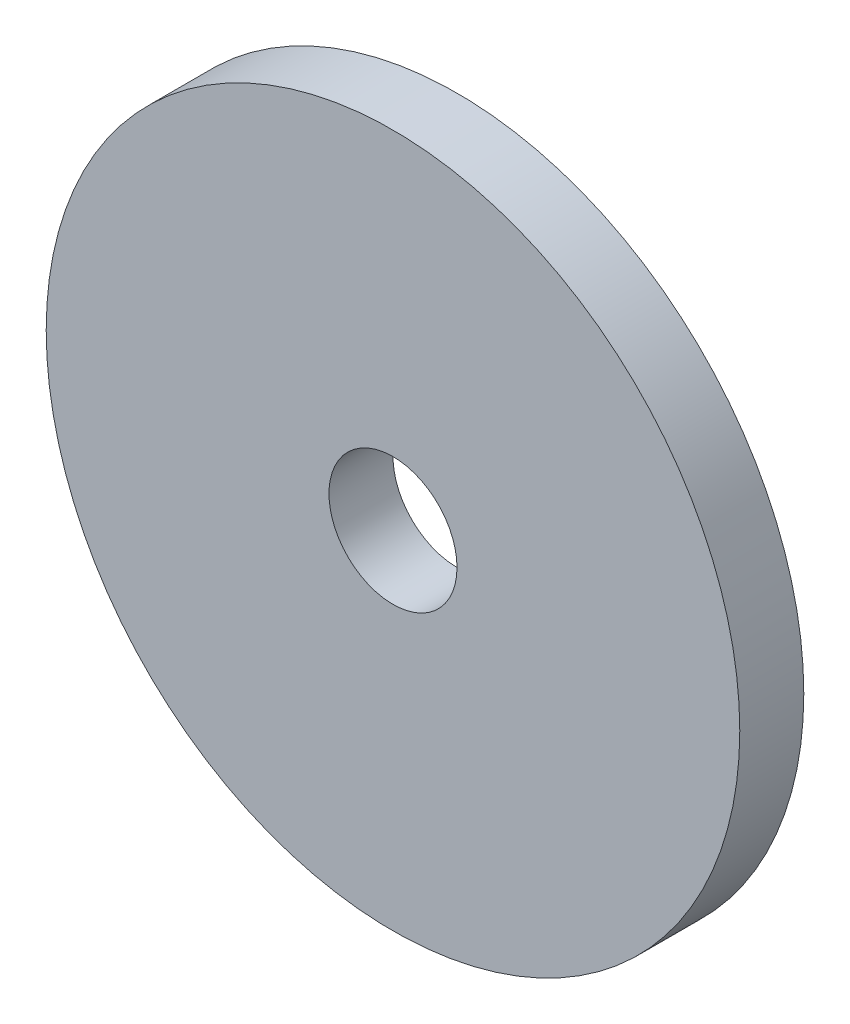
from build123d import *

# Parameters (mm, degrees)
SCHIZZO1_R                   = 32.5
SCHIZZO1_R_2                 = 6
ESTRUSIONE_ESTRUSIONE1_DEPTH = 3


with BuildPart() as part:
    # Schizzo1 → Estrusione-Estrusione1 (new, symmetric)
    with BuildSketch(Plane.XY):
        Circle(SCHIZZO1_R)
        Circle(SCHIZZO1_R_2, mode=Mode.SUBTRACT)
    extrude(amount=ESTRUSIONE_ESTRUSIONE1_DEPTH, both=True)


solid = part.part
